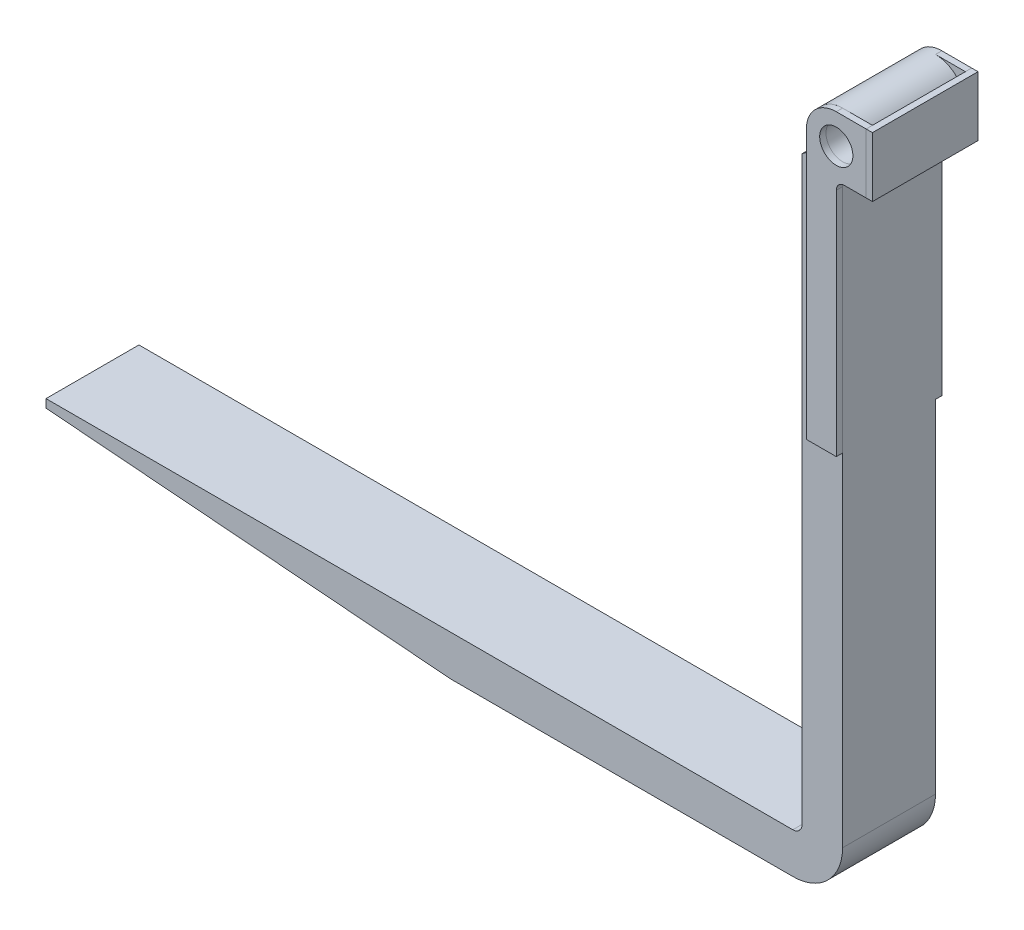
from build123d import *

# Parameters (mm, degrees)
EXTRUDE_THIN1_DEPTH     = 70
CUT_EXTRUDE2_DEPTH      = 1537.912489376
CUT_EXTRUDE2_DEPTH_BACK = 1537.912489376
SKETCH3_R               = 45
SKETCH3_R_2             = 25
BOSS_EXTRUDE1_DEPTH     = 70
BOSS_EXTRUDE2_DEPTH     = 70
SKETCH5_R               = 45
SKETCH5_R_2             = 25
BOSS_EXTRUDE3_DEPTH     = 9.5
SKETCH6_W               = 159
SKETCH6_H               = 90
BOSS_EXTRUDE4_DEPTH     = 9.5


with BuildPart() as part:
    # Sketch1 → Extrude-Thin1 (new, symmetric)
    with BuildSketch(Plane.XY):
        with BuildLine():
            Line((-1200, 0), (-75, 0))
            ThreePointArc((-75, 0), (-21.966991411, 21.966991411), (0, 75))
            Line((0, 75), (0, 950))
            Line((0, 950), (-61, 950))
            Line((-61, 950), (-61, 75))
            ThreePointArc((-61, 75), (-65.100505063, 65.100505063), (-75, 61))
            Line((-75, 61), (-1200, 61))
            Line((-1200, 61), (-1200, 0))
        make_face()
    extrude(amount=EXTRUDE_THIN1_DEPTH, both=True)

    # Sketch2 → Cut-Extrude2 (cut, two sides: drawn at the far end of the back side and taken through both)
    with BuildSketch(Plane.XY.offset(70).offset(-CUT_EXTRUDE2_DEPTH_BACK)):
        Polygon((-4202.326226889, 287.209544269), (-1200, 48.5), (-590, 0), (2412.326226889, -238.709544269), (1934.907138351, -6243.361998046), (-4679.745315427, -5717.442909508), align=None)
    extrude(amount=CUT_EXTRUDE2_DEPTH + CUT_EXTRUDE2_DEPTH_BACK, mode=Mode.SUBTRACT)


with BuildPart() as body_2:
    # Sketch3 → Boss-Extrude1 (new, symmetric)
    with BuildSketch(Plane.XY):
        with Locations((0, 995)):
            Circle(SKETCH3_R)
        with Locations((0, 995)):
            Circle(SKETCH3_R_2, mode=Mode.SUBTRACT)
    extrude(amount=BOSS_EXTRUDE1_DEPTH, both=True)


with BuildPart() as body_3:
    # Sketch4 → Boss-Extrude2 (new, symmetric)
    with BuildSketch(Plane.XY):
        with BuildLine():
            Line((-36.212585863, 968.285797314), (-61, 950))
            Line((-61, 950), (0, 950))
            ThreePointArc((0, 950), (-20.283748164, 954.830738612), (-36.212585863, 968.285797314))
        make_face()
    extrude(amount=BOSS_EXTRUDE2_DEPTH, both=True)


with BuildPart() as body_4:
    # Sketch5 → Boss-Extrude3 (new body)
    # profile 1 of 3: a face of its own
    with BuildSketch(Plane.XY.offset(70)):
        with Locations((0, 995)):
            Circle(SKETCH5_R)
        with Locations((0, 995)):
            Circle(SKETCH5_R_2, mode=Mode.SUBTRACT)
    # profile 2 of 3: a face of its own
    with BuildSketch(Plane.XY.offset(70)):
        with BuildLine():
            Line((45, 1040), (0, 1040))
            ThreePointArc((0, 1040), (31.819805153, 1026.819805153), (45, 995))
            Line((45, 995), (45, 1040))
        make_face()
    # profile 3 of 3: a face of its own
    with BuildSketch(Plane.XY.offset(70)):
        with BuildLine():
            ThreePointArc((45, 995), (0, 950), (-45, 995))
            Line((-45, 995), (-45, 590))
            Line((-45, 590), (0, 590))
            Line((0, 590), (0, 937.5))
            ThreePointArc((0, 937.5), (3.661165235, 946.338834765), (12.5, 950))
            Line((12.5, 950), (45, 950))
            Line((45, 950), (45, 995))
        make_face()
    boss_extrude3 = extrude(amount=BOSS_EXTRUDE3_DEPTH)


with BuildPart() as part_1:
    add(part.part)

    add(body_2.part)  # Mirror2 merges body 2

    add(body_3.part)  # Mirror2 merges body 3
    # Mirror2: Boss-Extrude3 across plane
    add(boss_extrude3.mirror(Plane.XY))


with BuildPart() as body_3_2:
    # Sketch6 → Boss-Extrude4 (new body)
    with BuildSketch(Plane(origin=(45, 0, 0), x_dir=(0, 0, -1), z_dir=(1, 0, 0))):
        with Locations((0, 995)):
            Rectangle(SKETCH6_W, SKETCH6_H)
    extrude(amount=BOSS_EXTRUDE4_DEPTH)


solid = Compound([body_4.part, part_1.part, body_3_2.part])
